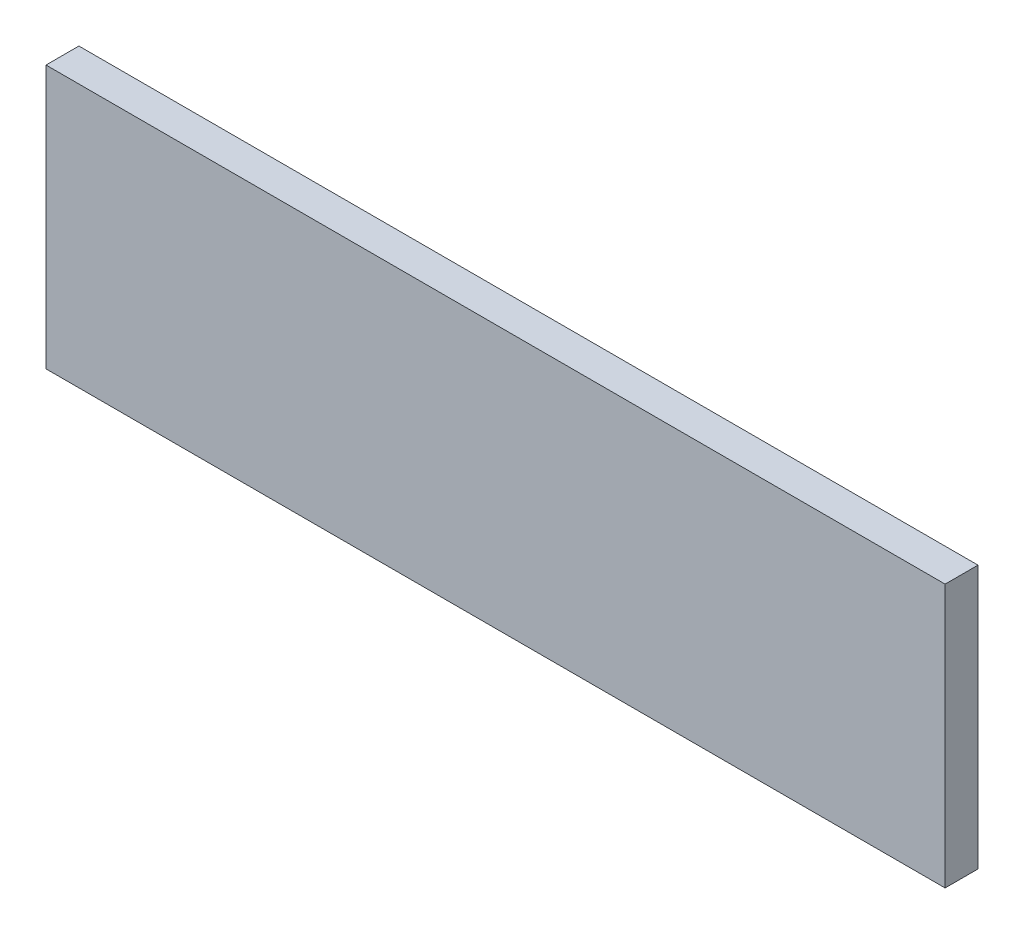
from build123d import *

# Parameters (mm, degrees)
SKETCH_1_W      = 410
SKETCH_1_H      = 120
EXTRUDE_1_DEPTH = 15


with BuildPart() as part:
    # 草图1 → 凸台-拉伸1 (new body)
    with BuildSketch(Plane.XY):
        Rectangle(SKETCH_1_W, SKETCH_1_H)
    extrude(amount=EXTRUDE_1_DEPTH)


solid = part.part
